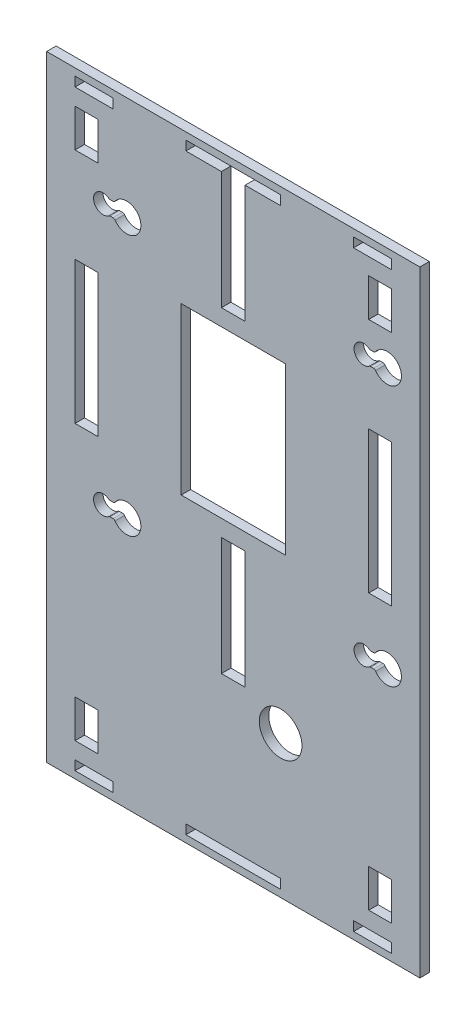
from build123d import *

# Parameters (mm, degrees)
SKETCH1_W              = 78.789320596
SKETCH1_H              = 130
PANEL_DEPTH            = 2
SUCKER_HOLES_REACH     = 206.318
FILLET1_R              = 0.5
SIDE_PLATE_SLOTS_REACH = 206.318
SKETCH3_W              = 22
SKETCH3_H              = 35
SKETCH3_W_2            = 5
SKETCH3_H_2            = 24.894660299
SKETCH3_W_3            = 8
SKETCH3_H_3            = 2
SKETCH3_W_4            = 4.8
SKETCH3_H_4            = 8
SKETCH3_H_5            = 30
SKETCH3_W_5            = 20
CUT_EXTRUDE3_REACH     = 206.318
SKETCH4_R              = 4.5


with BuildPart() as part:
    # Sketch1 → panel (new body)
    with BuildSketch(Plane.XY.offset(16.6)):
        with Locations((0, 135.474649456)):
            Rectangle(SKETCH1_W, SKETCH1_H)
    extrude(amount=PANEL_DEPTH)

    # Sketch2 → sucker holes (cut, up to next)
    with BuildSketch(Plane.XY.offset(18.6), mode=Mode.PRIVATE) as sucker_holes_sk1:
        with BuildLine():
            ThreePointArc((-26.177124344, 125.079989158), (-29.5, 123.579989158), (-26.177124344, 122.079989158))
            Line((-26.177124344, 122.079989158), (-25.098076211, 122.079989158))
            ThreePointArc((-25.098076211, 122.079989158), (-19.5, 123.579989158), (-25.098076211, 125.079989158))
            Line((-25.098076211, 125.079989158), (-26.177124344, 125.079989158))
        make_face()
    sucker_holes_tool1 = extrude(sucker_holes_sk1.sketch, amount=-SUCKER_HOLES_REACH, mode=Mode.PRIVATE) & part.part
    # Sketch2 → sucker holes (cut, up to next)
    with BuildSketch(Plane.XY.offset(18.6), mode=Mode.PRIVATE) as sucker_holes_sk2:
        with BuildLine():
            ThreePointArc((-26.177124344, 180.079989158), (-29.5, 178.579989158), (-26.177124344, 177.079989158))
            Line((-26.177124344, 177.079989158), (-25.098076211, 177.079989158))
            ThreePointArc((-25.098076211, 177.079989158), (-19.5, 178.579989158), (-25.098076211, 180.079989158))
            Line((-25.098076211, 180.079989158), (-26.177124344, 180.079989158))
        make_face()
    sucker_holes_tool2 = extrude(sucker_holes_sk2.sketch, amount=-SUCKER_HOLES_REACH, mode=Mode.PRIVATE) & part.part
    # Sketch2 → sucker holes (cut, up to next)
    with BuildSketch(Plane.XY.offset(18.6), mode=Mode.PRIVATE) as sucker_holes_sk3:
        with BuildLine():
            ThreePointArc((28.822875656, 180.079989158), (25.5, 178.579989158), (28.822875656, 177.079989158))
            Line((28.822875656, 177.079989158), (29.901923789, 177.079989158))
            ThreePointArc((29.901923789, 177.079989158), (35.5, 178.579989158), (29.901923789, 180.079989158))
            Line((29.901923789, 180.079989158), (28.822875656, 180.079989158))
        make_face()
    sucker_holes_tool3 = extrude(sucker_holes_sk3.sketch, amount=-SUCKER_HOLES_REACH, mode=Mode.PRIVATE) & part.part
    # Sketch2 → sucker holes (cut, up to next)
    with BuildSketch(Plane.XY.offset(18.6), mode=Mode.PRIVATE) as sucker_holes_sk4:
        with BuildLine():
            ThreePointArc((28.822875656, 125.079989158), (25.5, 123.579989158), (28.822875656, 122.079989158))
            Line((28.822875656, 122.079989158), (29.901923789, 122.079989158))
            ThreePointArc((29.901923789, 122.079989158), (35.5, 123.579989158), (29.901923789, 125.079989158))
            Line((29.901923789, 125.079989158), (28.822875656, 125.079989158))
        make_face()
    sucker_holes_tool4 = extrude(sucker_holes_sk4.sketch, amount=-SUCKER_HOLES_REACH, mode=Mode.PRIVATE) & part.part
    add(sucker_holes_tool1.solids().sort_by_distance((-24.075669, 123.579989, 18.6))[0], mode=Mode.SUBTRACT)
    add(sucker_holes_tool2.solids().sort_by_distance((-24.075669, 178.579989, 18.6))[0], mode=Mode.SUBTRACT)
    add(sucker_holes_tool3.solids().sort_by_distance((30.924331, 178.579989, 18.6))[0], mode=Mode.SUBTRACT)
    add(sucker_holes_tool4.solids().sort_by_distance((30.924331, 123.579989, 18.6))[0], mode=Mode.SUBTRACT)

    # Fillet1
    fillet1_edges = [part.edges().sort_by_distance(p)[0] for p in [
        (-26.177124344, 125.079989158, 17.6),
        (-25.098076211, 125.079989158, 17.6),
        (-25.098076211, 122.079989158, 17.6),
        (-26.177124344, 122.079989158, 17.6),
        (-25.098076211, 177.079989158, 17.6),
        (-26.177124344, 177.079989158, 17.6),
        (-26.177124344, 180.079989158, 17.6),
        (-25.098076211, 180.079989158, 17.6),
        (29.901923789, 177.079989158, 17.6),
        (28.822875656, 177.079989158, 17.6),
        (28.822875656, 180.079989158, 17.6),
        (29.901923789, 180.079989158, 17.6),
        (29.901923789, 122.079989158, 17.6),
        (28.822875656, 122.079989158, 17.6),
        (28.822875656, 125.079989158, 17.6),
        (29.901923789, 125.079989158, 17.6),
    ]]
    fillet(fillet1_edges, radius=FILLET1_R)

    # Sketch3 → side plate slots (cut, up to next)
    with BuildSketch(Plane.XY.offset(18.6), mode=Mode.PRIVATE) as side_plate_slots_sk1:
        with Locations((0, 151.079989158)):
            Rectangle(SKETCH3_W, SKETCH3_H)
    side_plate_slots_tool1 = extrude(side_plate_slots_sk1.sketch, amount=-SIDE_PLATE_SLOTS_REACH, mode=Mode.PRIVATE) & part.part
    # Sketch3 → side plate slots (cut, up to next)
    with BuildSketch(Plane.XY.offset(18.6), mode=Mode.PRIVATE) as side_plate_slots_sk2:
        Polygon((-2.5, 196.974649456), (-2.5, 172.079989158), (2.5, 172.079989158), (2.5, 196.974649456), (10, 196.974649456), (10, 198.974649456), (-10, 198.974649456), (-10, 196.974649456), align=None)
    side_plate_slots_tool2 = extrude(side_plate_slots_sk2.sketch, amount=-SIDE_PLATE_SLOTS_REACH, mode=Mode.PRIVATE) & part.part
    # Sketch3 → side plate slots (cut, up to next)
    with BuildSketch(Plane.XY.offset(18.6), mode=Mode.PRIVATE) as side_plate_slots_sk3:
        with Locations((0, 117.632659009)):
            Rectangle(SKETCH3_W_2, SKETCH3_H_2)
    side_plate_slots_tool3 = extrude(side_plate_slots_sk3.sketch, amount=-SIDE_PLATE_SLOTS_REACH, mode=Mode.PRIVATE) & part.part
    # Sketch3 → side plate slots (cut, up to next)
    with BuildSketch(Plane.XY.offset(18.6), mode=Mode.PRIVATE) as side_plate_slots_sk4:
        with Locations((-29.4, 72.974649456)):
            Rectangle(SKETCH3_W_3, SKETCH3_H_3)
    side_plate_slots_tool4 = extrude(side_plate_slots_sk4.sketch, amount=-SIDE_PLATE_SLOTS_REACH, mode=Mode.PRIVATE) & part.part
    # Sketch3 → side plate slots (cut, up to next)
    with BuildSketch(Plane.XY.offset(18.6), mode=Mode.PRIVATE) as side_plate_slots_sk5:
        with Locations((-29.4, 197.974649456)):
            Rectangle(SKETCH3_W_3, SKETCH3_H_3)
    side_plate_slots_tool5 = extrude(side_plate_slots_sk5.sketch, amount=-SIDE_PLATE_SLOTS_REACH, mode=Mode.PRIVATE) & part.part
    # Sketch3 → side plate slots (cut, up to next)
    with BuildSketch(Plane.XY.offset(18.6), mode=Mode.PRIVATE) as side_plate_slots_sk6:
        with Locations((29.4, 197.974649456)):
            Rectangle(SKETCH3_W_3, SKETCH3_H_3)
    side_plate_slots_tool6 = extrude(side_plate_slots_sk6.sketch, amount=-SIDE_PLATE_SLOTS_REACH, mode=Mode.PRIVATE) & part.part
    # Sketch3 → side plate slots (cut, up to next)
    with BuildSketch(Plane.XY.offset(18.6), mode=Mode.PRIVATE) as side_plate_slots_sk7:
        with Locations((-31, 189.474649456)):
            Rectangle(SKETCH3_W_4, SKETCH3_H_4)
    side_plate_slots_tool7 = extrude(side_plate_slots_sk7.sketch, amount=-SIDE_PLATE_SLOTS_REACH, mode=Mode.PRIVATE) & part.part
    # Sketch3 → side plate slots (cut, up to next)
    with BuildSketch(Plane.XY.offset(18.6), mode=Mode.PRIVATE) as side_plate_slots_sk8:
        with Locations((-31, 150.474649456)):
            Rectangle(SKETCH3_W_4, SKETCH3_H_5)
    side_plate_slots_tool8 = extrude(side_plate_slots_sk8.sketch, amount=-SIDE_PLATE_SLOTS_REACH, mode=Mode.PRIVATE) & part.part
    # Sketch3 → side plate slots (cut, up to next)
    with BuildSketch(Plane.XY.offset(18.6), mode=Mode.PRIVATE) as side_plate_slots_sk9:
        with Locations((-31, 81.474649456)):
            Rectangle(SKETCH3_W_4, SKETCH3_H_4)
    side_plate_slots_tool9 = extrude(side_plate_slots_sk9.sketch, amount=-SIDE_PLATE_SLOTS_REACH, mode=Mode.PRIVATE) & part.part
    # Sketch3 → side plate slots (cut, up to next)
    with BuildSketch(Plane.XY.offset(18.6), mode=Mode.PRIVATE) as side_plate_slots_sk10:
        with Locations((31, 81.474649456)):
            Rectangle(SKETCH3_W_4, SKETCH3_H_4)
    side_plate_slots_tool10 = extrude(side_plate_slots_sk10.sketch, amount=-SIDE_PLATE_SLOTS_REACH, mode=Mode.PRIVATE) & part.part
    # Sketch3 → side plate slots (cut, up to next)
    with BuildSketch(Plane.XY.offset(18.6), mode=Mode.PRIVATE) as side_plate_slots_sk11:
        with Locations((31, 150.474649456)):
            Rectangle(SKETCH3_W_4, SKETCH3_H_5)
    side_plate_slots_tool11 = extrude(side_plate_slots_sk11.sketch, amount=-SIDE_PLATE_SLOTS_REACH, mode=Mode.PRIVATE) & part.part
    # Sketch3 → side plate slots (cut, up to next)
    with BuildSketch(Plane.XY.offset(18.6), mode=Mode.PRIVATE) as side_plate_slots_sk12:
        with Locations((31, 189.474649456)):
            Rectangle(SKETCH3_W_4, SKETCH3_H_4)
    side_plate_slots_tool12 = extrude(side_plate_slots_sk12.sketch, amount=-SIDE_PLATE_SLOTS_REACH, mode=Mode.PRIVATE) & part.part
    # Sketch3 → side plate slots (cut, up to next)
    with BuildSketch(Plane.XY.offset(18.6), mode=Mode.PRIVATE) as side_plate_slots_sk13:
        with Locations((29.4, 72.974649456)):
            Rectangle(SKETCH3_W_3, SKETCH3_H_3)
    side_plate_slots_tool13 = extrude(side_plate_slots_sk13.sketch, amount=-SIDE_PLATE_SLOTS_REACH, mode=Mode.PRIVATE) & part.part
    # Sketch3 → side plate slots (cut, up to next)
    with BuildSketch(Plane.XY.offset(18.6), mode=Mode.PRIVATE) as side_plate_slots_sk14:
        with Locations((0, 72.974649456)):
            Rectangle(SKETCH3_W_5, SKETCH3_H_3)
    side_plate_slots_tool14 = extrude(side_plate_slots_sk14.sketch, amount=-SIDE_PLATE_SLOTS_REACH, mode=Mode.PRIVATE) & part.part
    add(side_plate_slots_tool1.solids().sort_by_distance((0, 151.079989, 18.6))[0], mode=Mode.SUBTRACT)
    add(side_plate_slots_tool2.solids().sort_by_distance((0, 187.797718, 18.6))[0], mode=Mode.SUBTRACT)
    add(side_plate_slots_tool3.solids().sort_by_distance((0, 117.632659, 18.6))[0], mode=Mode.SUBTRACT)
    add(side_plate_slots_tool4.solids().sort_by_distance((-29.4, 72.974649, 18.6))[0], mode=Mode.SUBTRACT)
    add(side_plate_slots_tool5.solids().sort_by_distance((-29.4, 197.974649, 18.6))[0], mode=Mode.SUBTRACT)
    add(side_plate_slots_tool6.solids().sort_by_distance((29.4, 197.974649, 18.6))[0], mode=Mode.SUBTRACT)
    add(side_plate_slots_tool7.solids().sort_by_distance((-31, 189.474649, 18.6))[0], mode=Mode.SUBTRACT)
    add(side_plate_slots_tool8.solids().sort_by_distance((-31, 150.474649, 18.6))[0], mode=Mode.SUBTRACT)
    add(side_plate_slots_tool9.solids().sort_by_distance((-31, 81.474649, 18.6))[0], mode=Mode.SUBTRACT)
    add(side_plate_slots_tool10.solids().sort_by_distance((31, 81.474649, 18.6))[0], mode=Mode.SUBTRACT)
    add(side_plate_slots_tool11.solids().sort_by_distance((31, 150.474649, 18.6))[0], mode=Mode.SUBTRACT)
    add(side_plate_slots_tool12.solids().sort_by_distance((31, 189.474649, 18.6))[0], mode=Mode.SUBTRACT)
    add(side_plate_slots_tool13.solids().sort_by_distance((29.4, 72.974649, 18.6))[0], mode=Mode.SUBTRACT)
    add(side_plate_slots_tool14.solids().sort_by_distance((0, 72.974649, 18.6))[0], mode=Mode.SUBTRACT)

    # Sketch4 → Cut-Extrude3 (cut, up to next)
    with BuildSketch(Plane.XY.offset(18.6), mode=Mode.PRIVATE) as cut_extrude3_sk1:
        with Locations((10, 100.474649456)):
            Circle(SKETCH4_R)
    cut_extrude3_tool1 = extrude(cut_extrude3_sk1.sketch, amount=-CUT_EXTRUDE3_REACH, mode=Mode.PRIVATE) & part.part
    add(cut_extrude3_tool1.solids().sort_by_distance((10, 100.474649, 18.6))[0], mode=Mode.SUBTRACT)


solid = part.part
